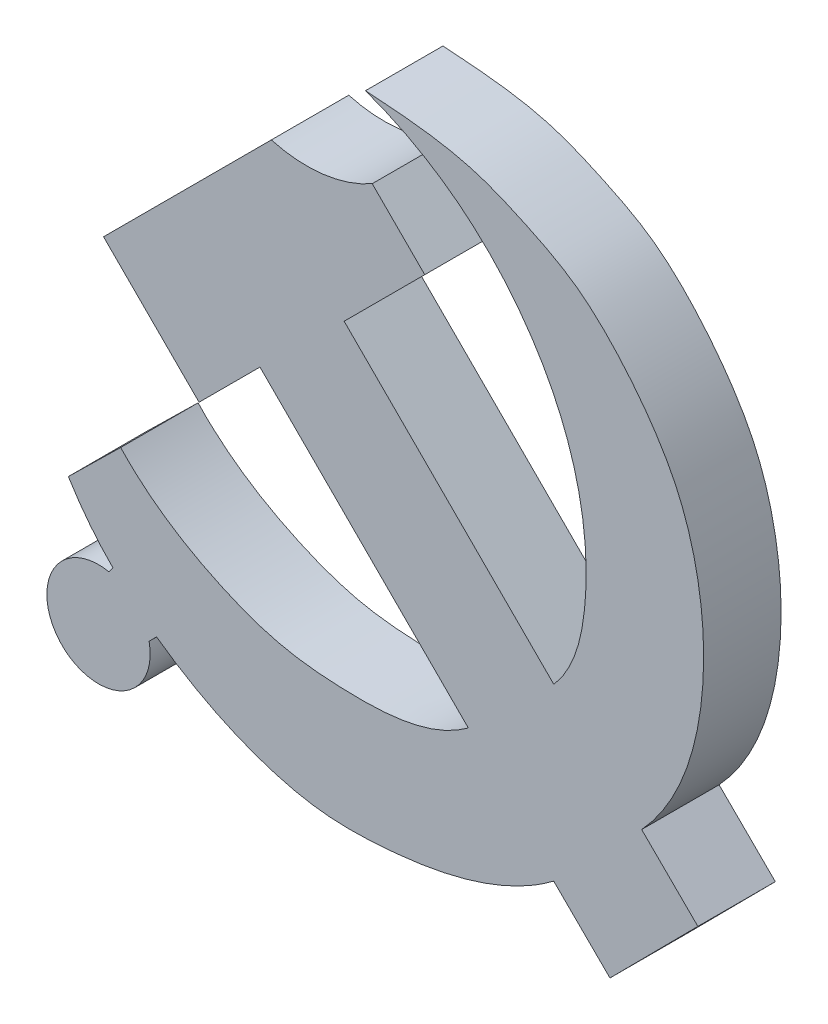
from build123d import *

# Parameters (mm, degrees)
EXTRUDE_1_DEPTH = 30


with BuildPart() as part:
    # 草图1 → 凸台-拉伸1 (new body)
    with BuildSketch(Plane.XY):
        with BuildLine():
            Line((-89.550424061, 9.743331503), (-65.958441791, 33.335313773))
            Line((-65.958441791, 33.335313773), (14.763144604, -47.386272621))
            add(Edge.make_bspline(
                [(14.763144604, -47.386272621), (0.494407811, -57.892318184), (-24.857012127, -59.689840271), (-58.186688521, -56.851240275), (-88.692238529, -45.382338902), (-109.075510722, -32.199451169), (-119.928178624, -20.63442306)],
                knots=[0, 0, 0, 0, 0.341115549, 0.507979438, 0.680177262, 1, 1, 1, 1], degree=3))
            Line((-119.928178624, -20.63442306), (-140.199044416, -40.51331885))
            add(Edge.make_bspline(
                [(-140.199044416, -40.51331885), (-132.851023827, -52.488780749), (-122.952075778, -62.464006208)],
                knots=[0, 0, 0, 1, 1, 1], degree=2))
            Line((-122.952075778, -62.464006208), (-124.511456774, -64.591840844))
            ThreePointArc((-124.511456774, -64.591840844), (-142.61936624, -98.390264744), (-108.909761073, -80.117542921))
            Line((-108.909761073, -80.117542921), (-106.018688387, -77.202324863))
            add(Edge.make_bspline(
                [(-106.018688387, -77.202324863), (-93.714859758, -86.031565942), (-72.92911338, -97.233004689), (-42.077489767, -104.91243417), (-17.024761238, -104.223351741), (14.056661387, -100.072035401), (36.008728716, -91.143735824), (47.83817857, -82.224550687)],
                knots=[0, 0, 0, 0, 0.276360348, 0.427878613, 0.575006209, 0.731440466, 1, 1, 1, 1], degree=3))
            Line((47.83817857, -82.224550687), (69.622057976, -103.828004523))
            Line((69.622057976, -103.828004523), (103.685759612, -69.479813065))
            Line((103.685759612, -69.479813065), (81.901880206, -47.876359228))
            add(Edge.make_bspline(
                [(-25.095901705, 146.484591642), (-10.567098374, 145.498050051), (11.160613299, 144.072831183), (37.531334045, 132.583388034), (55.897612016, 123.332823339), (71.537157173, 108.672601965), (84.710460364, 92.54260553), (97.252459301, 72.155728995), (105.276260592, 44.815754295), (107.60340097, 1.722304289), (97.111827436, -31.457580928), (81.901880206, -47.876359228)],
                knots=[0, 0, 0, 0, 0.159868672, 0.229200296, 0.310741288, 0.380982582, 0.45929677, 0.536185558, 0.638541511, 0.764116301, 1, 1, 1, 1], degree=3))
            add(Edge.make_bspline(
                [(-25.095901705, 146.484591642), (-8.963236942, 140.754746766), (13.87303757, 127.036506772), (36.100717553, 101.745358423), (48.669739491, 80.953224615), (56.825285706, 59.482294206), (60.519405197, 37.995942764), (60.521784194, 11.949353151), (56.293651863, -6.693592279), (47.83817857, -16.161590205)],
                knots=[0, 0, 0, 0, 0.253918506, 0.386919221, 0.496446637, 0.613180361, 0.7259311, 0.817885326, 1, 1, 1, 1], degree=3))
            Line((47.83817857, -16.161590205), (-33.345995712, 65.022584077))
            Line((-33.345995712, 65.022584077), (-2.121313296, 96.247266493))
            Line((-2.121313296, 96.247266493), (-22.475180352, 116.60113355))
            ThreePointArc((-22.475180352, 116.60113355), (-41.533061284, 110.257723938), (-61.563856858, 111.74396073))
            Line((-61.563856858, 111.74396073), (-126.557455073, 46.750362515))
            Line((-126.557455073, 46.750362515), (-89.550424061, 9.743331503))
        make_face()
    extrude(amount=EXTRUDE_1_DEPTH)


solid = part.part
